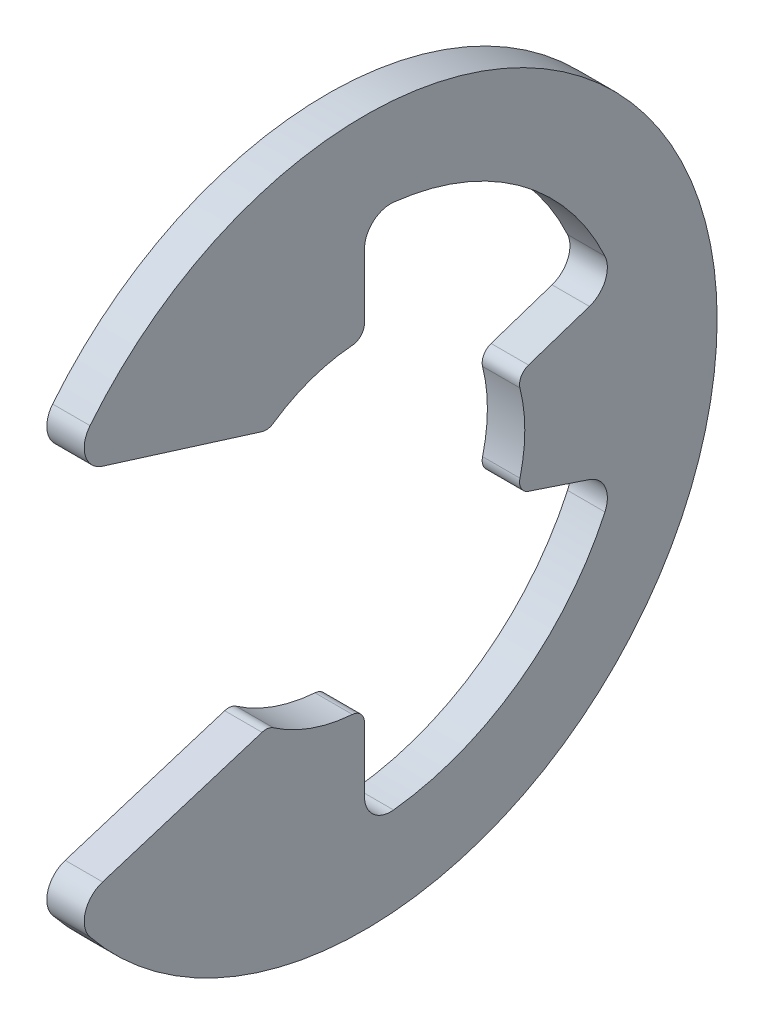
from build123d import *

# Parameters (mm, degrees)
BOSS_EXTRUDE1_DEPTH      = 0.4445
BOSS_EXTRUDE1_DEPTH_BACK = 0.4445
FILLET1_R                = 0.6223
FILLET2_R                = 0.31115


with BuildPart() as part:
    # Sketch3 → Boss-Extrude1 (new, two sides: drawn at the far end of the back side and taken through both)
    with BuildSketch(Plane(origin=(0, 0, 0), x_dir=(0, 0, -1), z_dir=(1, 0, 0)).offset(-BOSS_EXTRUDE1_DEPTH_BACK)):
        with BuildLine():
            Line((3.614483366, -1.204827789), (5.969727365, -1.989909122))
            ThreePointArc((5.969727365, -1.989909122), (3.679374344, -5.104859211), (0, -6.292645161))
            Line((0, -6.292645161), (0, -3.81))
            ThreePointArc((0, -3.81), (-1.204827789, -3.614483366), (-2.286, -3.048))
            Line((-2.286, -3.048), (-7.048739855, -4.535767901))
            ThreePointArc((-7.048739855, -4.535767901), (8.382, 0), (-7.048739855, 4.535767901))
            Line((-7.048739855, 4.535767901), (-2.286, 3.048))
            ThreePointArc((-2.286, 3.048), (-1.204827789, 3.614483366), (0, 3.81))
            Line((0, 3.81), (0, 6.292645161))
            ThreePointArc((0, 6.292645161), (3.679374344, 5.104859211), (5.969727365, 1.989909122))
            Line((5.969727365, 1.989909122), (3.614483366, 1.204827789))
            ThreePointArc((3.614483366, 1.204827789), (3.81, 0), (3.614483366, -1.204827789))
        make_face()
    extrude(amount=BOSS_EXTRUDE1_DEPTH + BOSS_EXTRUDE1_DEPTH_BACK)

    # Fillet1
    fillet1_edges = [part.edges().sort_by_distance(p)[0] for p in [
        (0, 1.989909122, -5.969727365),
        (0, 6.292645161, 0),
        (0, 4.535767901, 7.048739855),
        (0, -4.535767901, 7.048739855),
        (0, -6.292645161, 0),
        (0, -1.989909122, -5.969727365),
    ]]
    fillet(fillet1_edges, radius=FILLET1_R)

    # Fillet2
    fillet2_edges = [part.edges().sort_by_distance(p)[0] for p in [
        (0, 1.204827789, -3.614483366),
        (0, 3.81, 0),
        (0, 3.048, 2.286),
        (0, -3.048, 2.286),
        (0, -3.81, 0),
        (0, -1.204827789, -3.614483366),
    ]]
    fillet(fillet2_edges, radius=FILLET2_R)


solid = part.part
